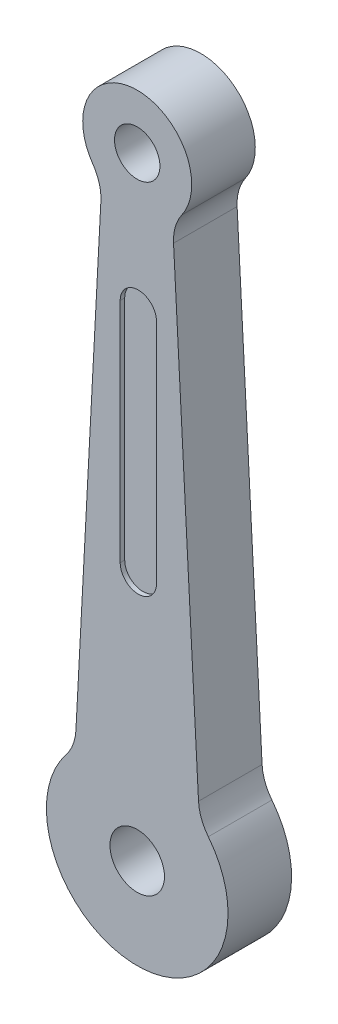
from build123d import *

# Parameters (mm, degrees)
SKETCH_1_R          = 6
SKETCH_1_R_2        = 5
EXTRUDE_1_DEPTH     = 14
CUT_EXTRUDE_1_DEPTH = 1
CUT_EXTRUDE_START   = -1
CUT_EXTRUDE_2_DEPTH = 1


with BuildPart() as part:
    # 草图1 → 拉伸1 (new body)
    with BuildSketch(Plane.XY):
        with BuildLine():
            Line((-8, 121.801117832), (-13.5, 18.135932445))
            ThreePointArc((-13.5, 18.135932445), (-14.135015735, 15.121742333), (-15.657303504, 12.443827667))
            ThreePointArc((-15.657303504, 12.443827667), (0, -20), (15.657303504, 12.443827667))
            ThreePointArc((15.657303504, 12.443827667), (14.135015735, 15.121742333), (13.5, 18.135932445))
            Line((13.5, 18.135932445), (8, 121.801117832))
            ThreePointArc((8, 121.801117832), (8.376311259, 125.097647375), (9.810521048, 128.089596484))
            ThreePointArc((9.810521048, 128.089596484), (0, 147), (-9.810521048, 128.089596484))
            ThreePointArc((-9.810521048, 128.089596484), (-8.376311259, 125.097647375), (-8, 121.801117832))
        make_face()
        Circle(SKETCH_1_R, mode=Mode.SUBTRACT)
        with Locations((0, 135)):
            Circle(SKETCH_1_R_2, mode=Mode.SUBTRACT)
    extrude(amount=-EXTRUDE_1_DEPTH)

    # 草图2 → 切除-拉伸1 (cut)
    with BuildSketch(Plane.XY):
        with BuildLine():
            Line((-3.75192728, 105), (-3.75192728, 55))
            ThreePointArc((-3.75192728, 55), (0.24807272, 51), (4.24807272, 55))
            Line((4.24807272, 55), (4.24807272, 105))
            ThreePointArc((4.24807272, 105), (0.24807272, 109), (-3.75192728, 105))
        make_face()
    extrude(amount=-CUT_EXTRUDE_1_DEPTH, mode=Mode.SUBTRACT)

    # 草图3 → 切除-拉伸2 (cut)
    with BuildSketch(Plane(origin=(0, 0, -14), x_dir=(-1, 0, 0), z_dir=(0, 0, -1)).offset(CUT_EXTRUDE_START)):
        with BuildLine():
            Line((3.75192728, 55), (3.75192728, 105))
            ThreePointArc((3.75192728, 105), (-0.24807272, 109), (-4.24807272, 105))
            Line((-4.24807272, 105), (-4.24807272, 55))
            ThreePointArc((-4.24807272, 55), (-0.24807272, 51), (3.75192728, 55))
        make_face()
    extrude(amount=CUT_EXTRUDE_2_DEPTH, mode=Mode.SUBTRACT)


solid = part.part
